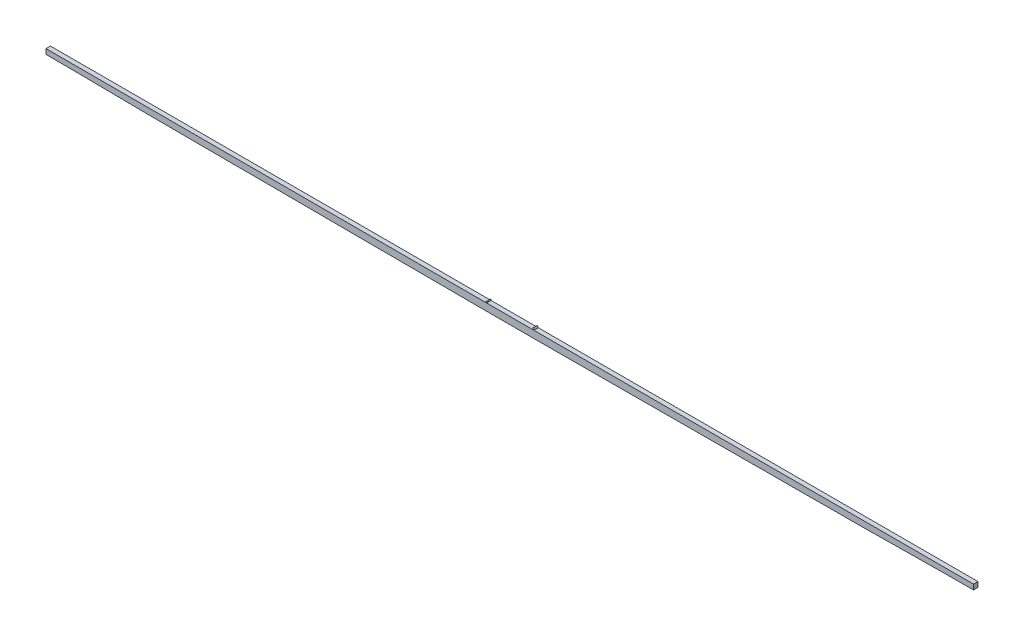
from build123d import *

# Parameters (mm, degrees)
EXTRUDE_3_DEPTH = 5


with BuildPart() as part:
    # Model → 凸台-拉伸3 (new body)
    with BuildSketch(Plane.XY):
        Polygon((143.754855357, 180.061566324), (637.766892066, 180.061566324), (637.766892066, 174.389466324), (635.766892066, 174.389466324), (607.417562069, 174.266766324), (605.417562069, 174.266766324), (522.753244134, 173.328437251), (520.753244134, 173.319766324), (431.767168163, 172.933970442), (429.767168163, 172.933966324), (413.767168163, 172.942566324), (411.767168163, 172.942566324), (313.517246909, 172.572666324), (311.517246909, 172.572666324), (223.517246909, 172.262766324), (221.517246909, 172.262766324), (142.758356713, 171.99776752), (116.762748322, 171.99776752), (90.767139931, 171.99776752), (12.008249736, 172.262766324), (10.008249736, 172.262766324), (-77.991750264, 172.572666324), (-79.991750264, 172.572666324), (-178.241671518, 172.942566324), (-180.241671518, 172.942566324), (-196.241671518, 172.933966324), (-198.241671518, 172.933970442), (-287.227747489, 173.319766324), (-289.227747489, 173.328437251), (-371.892065424, 174.266766324), (-373.892065424, 174.266766324), (-402.241395422, 174.389466324), (-404.241395422, 174.389466324), (-404.241395422, 180.061566324), (89.770641288, 180.061566324), (90.762748322, 181.881511431), (90.762748322, 180.061566324), (116.762748322, 180.061566324), (142.762748322, 180.061566324), (142.762748322, 181.881511431), align=None)
    extrude(amount=EXTRUDE_3_DEPTH)


solid = part.part
